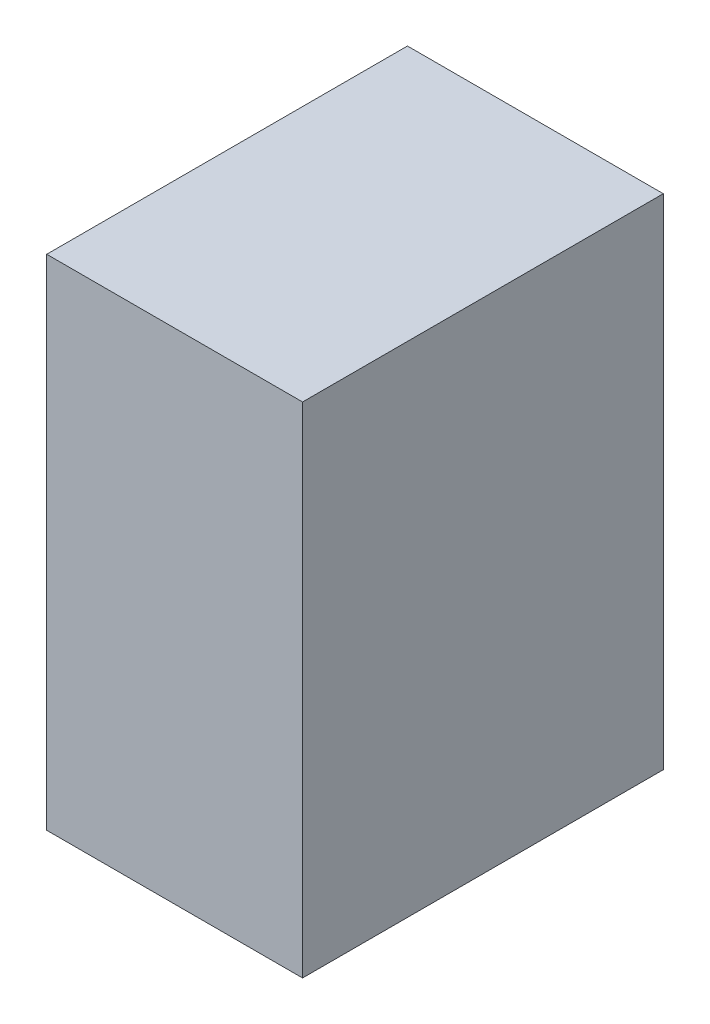
from build123d import *

# Parameters (mm, degrees)
SKETCH1_W           = 35.814
SKETCH1_H           = 49.53
BOSS_EXTRUDE1_DEPTH = 25.4


with BuildPart() as part:
    # Sketch1 → Boss-Extrude1 (new body)
    with BuildSketch(Plane(origin=(0, 0, 0), x_dir=(0, 0, -1), z_dir=(1, 0, 0))):
        with Locations((17.907, 24.765)):
            Rectangle(SKETCH1_W, SKETCH1_H)
    extrude(amount=BOSS_EXTRUDE1_DEPTH)


solid = part.part
